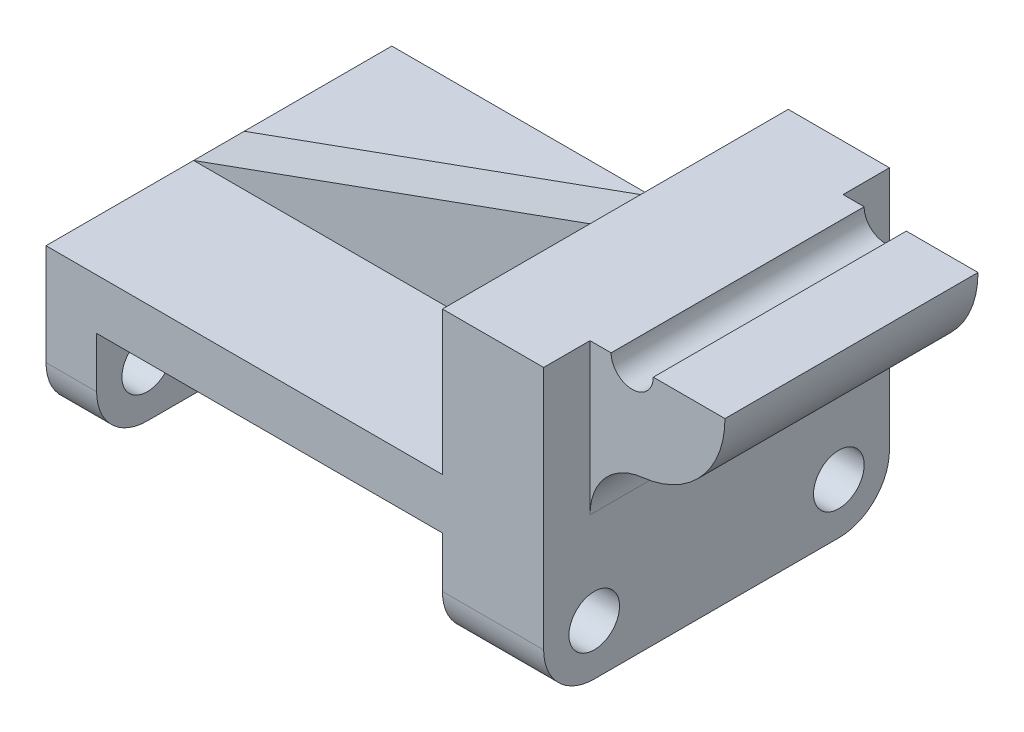
from build123d import *

# Parameters (mm, degrees)
BOSS_EXTRUDE1_DEPTH              = 41
BOSS_EXTRUDE1_DEPTH_BACK         = 41
FILLET1_R                        = 12
F_12_0MM_DOWEL_HOLE1_D           = 12
F_12_0MM_DOWEL_HOLE1_CSINK_D     = 12.05
F_12_0MM_DOWEL_HOLE1_CSINK_ANGLE = 90
BOSS_EXTRUDE2_DEPTH              = 30
BOSS_EXTRUDE2_DEPTH_BACK         = 30
SKETCH8_R                        = 5
CUT_EXTRUDE1_DEPTH               = 181.113852882
BOSS_EXTRUDE3_DEPTH              = 6
BOSS_EXTRUDE3_DEPTH_BACK         = 6


with BuildPart() as part:
    # Sketch1 → Boss-Extrude1 (new, two sides: drawn at the far end of the back side and taken through both)
    with BuildSketch(Plane.XY.offset(-BOSS_EXTRUDE1_DEPTH_BACK)):
        Polygon((0, 0), (0, 36), (94, 36), (94, 70), (118, 70), (118, 0), (94, 0), (94, 24), (12, 24), (12, 0), align=None)
    extrude(amount=BOSS_EXTRUDE1_DEPTH + BOSS_EXTRUDE1_DEPTH_BACK)

    # Fillet1
    fillet1_edges = [part.edges().sort_by_distance(p)[0] for p in [
        (106, 0, -41),
        (106, 0, 41),
        (6, 0, 41),
        (6, 0, -41),
    ]]
    fillet(fillet1_edges, radius=FILLET1_R)

    # Ø12.0mm Dowel Hole1 (through all)
    with Locations(Plane.ZY):
        with Locations((-29, 12), (29, 12)):
            CounterSinkHole(F_12_0MM_DOWEL_HOLE1_D / 2, F_12_0MM_DOWEL_HOLE1_CSINK_D / 2, counter_sink_angle=F_12_0MM_DOWEL_HOLE1_CSINK_ANGLE)

    # Sketch7 → Boss-Extrude2 (add, two sides: drawn at the far end of the back side and taken through both)
    with BuildSketch(Plane.XY.offset(-BOSS_EXTRUDE2_DEPTH_BACK)):
        with BuildLine():
            Line((118, 34.22291236), (118, 70))
            Line((118, 70), (128, 70))
            Line((128, 70), (150, 70))
            ThreePointArc((150, 70), (144.397831835, 55.333333333), (130.444444444, 48.13622422))
            ThreePointArc((130.444444444, 48.13622422), (121.565016105, 43.556245693), (118, 34.22291236))
        make_face()
    extrude(amount=BOSS_EXTRUDE2_DEPTH + BOSS_EXTRUDE2_DEPTH_BACK)

    # Sketch8 → Cut-Extrude1 (cut, through all)
    with BuildSketch(Plane.XY.offset(30)):
        with Locations((128, 70)):
            Circle(SKETCH8_R)
    extrude(amount=-CUT_EXTRUDE1_DEPTH, mode=Mode.SUBTRACT)

    # Sketch9 → Boss-Extrude3 (add, two sides: drawn at the far end of the back side and taken through both)
    with BuildSketch(Plane.XY.offset(-BOSS_EXTRUDE3_DEPTH_BACK)):
        Polygon((0, 36), (94, 70), (94, 36), align=None)
    extrude(amount=BOSS_EXTRUDE3_DEPTH + BOSS_EXTRUDE3_DEPTH_BACK)


solid = part.part
